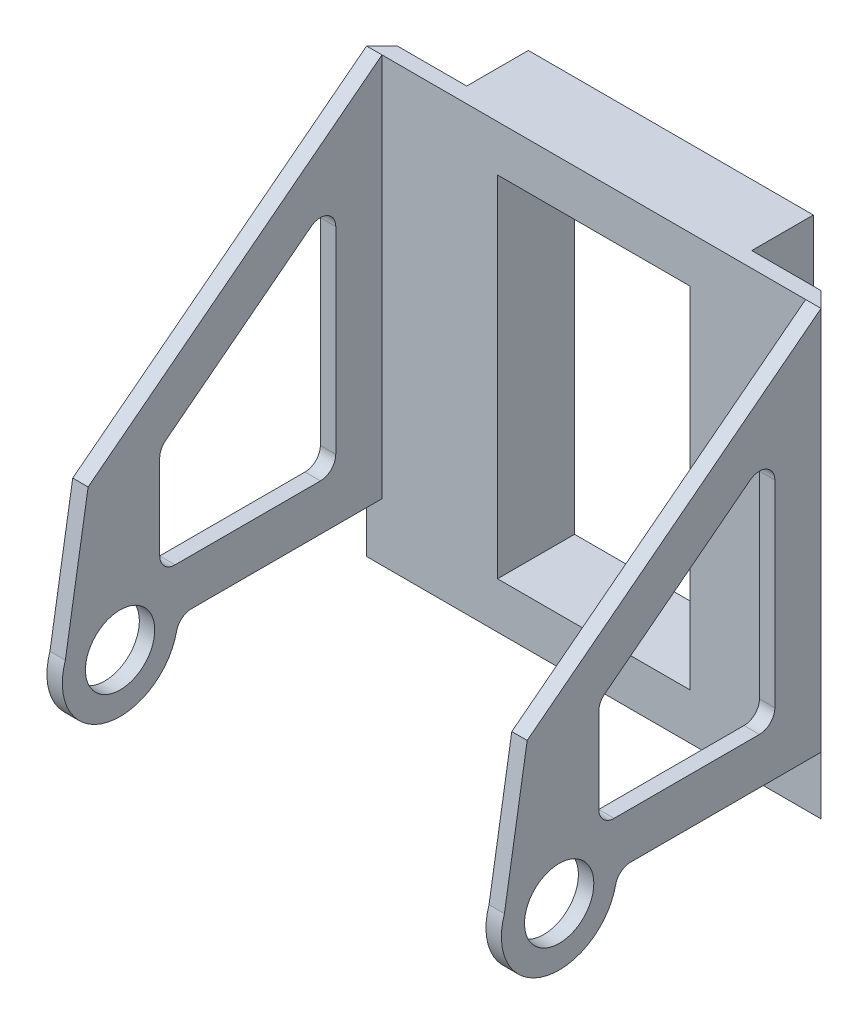
from build123d import *

# Parameters (mm, degrees)
SKETCH_1_W          = 18.5
SKETCH_1_H          = 28.7
SKETCH_1_W_2        = 12.5
SKETCH_1_H_2        = 22.7
EXTRUDE_1_DEPTH     = 5
EXTRUDE_2_DEPTH     = 28.7
CHAMFER_1_SIZE      = 1
SKETCH_3_W          = 13.25
SKETCH_3_H          = 3.75
CUT_EXTRUDE_1_DEPTH = 47.975951294
FILLET_1_R          = 1
CUT_EXTRUDE_2_DEPTH = 47.838045433
FILLET_2_R          = 1
SKETCH_6_R          = 2.25
CUT_EXTRUDE_3_DEPTH = 47.838045433


with BuildPart() as part:
    # 草图1 → 凸台-拉伸1 (new body)
    with BuildSketch(Plane.XY):
        with Locations((6.25, 11.35)):
            Rectangle(SKETCH_1_W, SKETCH_1_H)
        with Locations((6.25, 11.35)):
            Rectangle(SKETCH_1_W_2, SKETCH_1_H_2, mode=Mode.SUBTRACT)
    extrude(amount=EXTRUDE_1_DEPTH)

    # 草图2 → 凸台-拉伸2 (add)
    with BuildSketch(Plane.XZ.offset(3)):
        Polygon((-3, 5), (-3, 4), (-8.5, 4), (-8.5, 26), (-7.5, 26), (-7.5, 5), align=None)
        Polygon((20, 26), (20, 5), (15.5, 5), (15.5, 4), (21, 4), (21, 26), align=None)
    extrude(amount=-EXTRUDE_2_DEPTH)

    # 倒角1
    chamfer_1_edges = [part.edges().sort_by_distance(p)[0] for p in [
        (-8.5, 11.35, 4),
        (21, 11.35, 4),
    ]]
    chamfer(chamfer_1_edges, length=CHAMFER_1_SIZE)

    # 草图3 → 切除-拉伸1 (cut, through all)
    with BuildSketch(Plane(origin=(21, 0, 0), x_dir=(0, 0, -1), z_dir=(1, 0, 0))):
        with BuildLine():
            ThreePointArc((-25.75, 0.75), (-25.700415908, 1.357801045), (-25.552974874, 1.949528884))
            Line((-25.552974874, 1.949528884), (-24.074717326, 10.949460339))
            Line((-24.074717326, 10.949460339), (-5, 25.7))
            Line((-5, 25.7), (-26, 25.7))
            Line((-26, 25.7), (-26, 0.75))
            Line((-26, 0.75), (-25.75, 0.75))
        make_face()
        with BuildLine():
            Line((-26, -3), (-22, -3))
            ThreePointArc((-22, -3), (-24.651650429, -1.901650429), (-25.75, 0.75))
            Line((-25.75, 0.75), (-26, 0.75))
            Line((-26, 0.75), (-26, -3))
        make_face()
        with BuildLine():
            Line((-22, -3), (-18.25, -3))
            Line((-18.25, -3), (-18.25, 0.75))
            ThreePointArc((-18.25, 0.75), (-19.348349571, -1.901650429), (-22, -3))
        make_face()
        with Locations((-11.625, -1.125)):
            Rectangle(SKETCH_3_W, SKETCH_3_H)
    extrude(amount=-CUT_EXTRUDE_1_DEPTH, mode=Mode.SUBTRACT)

    # 圆角1
    fillet_1_edges = [part.edges().sort_by_distance(p)[0] for p in [
        (-8, 0.75, 18.25),
        (20.5, 0.75, 18.25),
    ]]
    fillet(fillet_1_edges, radius=FILLET_1_R)

    # 草图5 → 切除-拉伸2 (cut, through all)
    with BuildSketch(Plane(origin=(21, 0, 0), x_dir=(0, 0, -1), z_dir=(1, 0, 0))):
        Polygon((-19.428547646, 3.75), (-19.428547646, 10.75), (-8, 19.587732294), (-8, 3.75), align=None)
    extrude(amount=-CUT_EXTRUDE_2_DEPTH, mode=Mode.SUBTRACT)

    # 圆角2
    fillet_2_edges = [part.edges().sort_by_distance(p)[0] for p in [
        (-8, 3.75, 8),
        (-8, 3.75, 19.428547646),
        (-8, 10.75, 19.428547646),
        (-8, 19.587732294, 8),
        (20.5, 3.75, 8),
        (20.5, 3.75, 19.428547646),
        (20.5, 10.75, 19.428547646),
        (20.5, 19.587732294, 8),
    ]]
    fillet(fillet_2_edges, radius=FILLET_2_R)

    # 草图6 → 切除-拉伸3 (cut, through all)
    with BuildSketch(Plane(origin=(21, 0, 0), x_dir=(0, 0, -1), z_dir=(1, 0, 0))):
        with Locations((-22, 0.75)):
            Circle(SKETCH_6_R)
    extrude(amount=-CUT_EXTRUDE_3_DEPTH, mode=Mode.SUBTRACT)


solid = part.part
